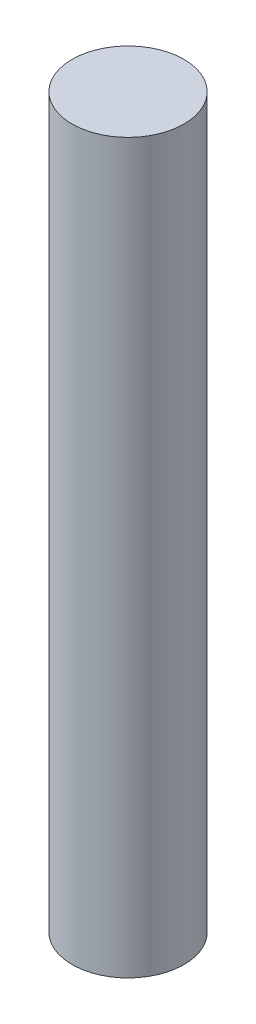
from build123d import *

# Parameters (mm, degrees)
MAIN_BODY_SKETCH_R      = 1
MAIN_BODY_EXTRUDE_DEPTH = 13


with BuildPart() as part:
    # Main Body Sketch → Main Body Extrude (new body)
    with BuildSketch(Plane(origin=(0, 0, 0), x_dir=(1, 0, 0), z_dir=(0, 1, 0))):
        with Locations(Location((0, 0, 0), (0, 0, 90))):
            Circle(MAIN_BODY_SKETCH_R)
    extrude(amount=MAIN_BODY_EXTRUDE_DEPTH)


solid = part.part
